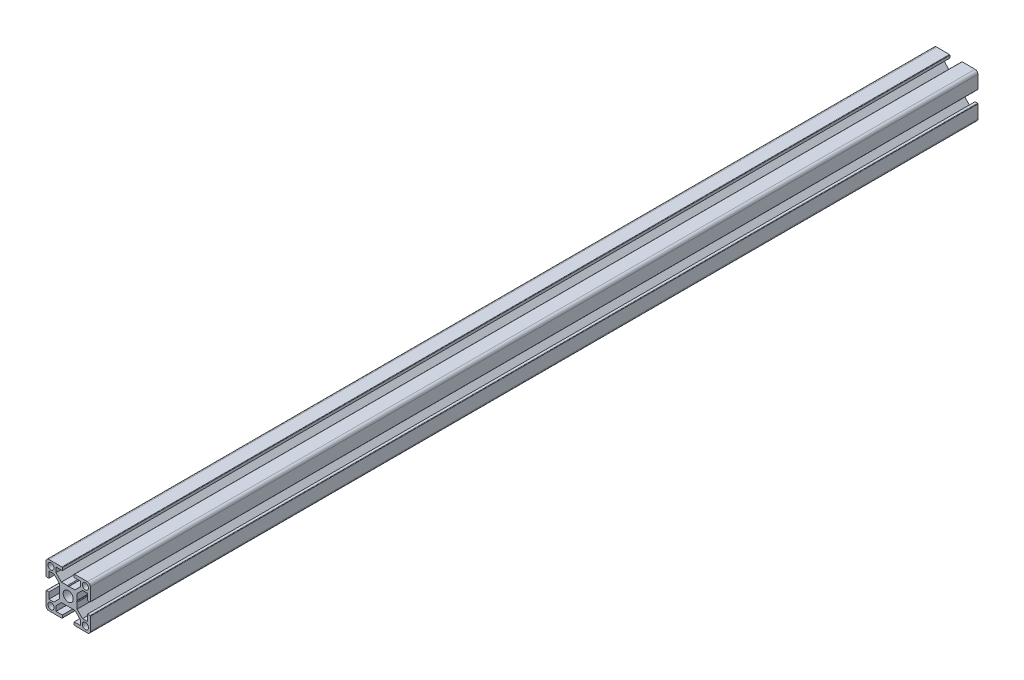
from build123d import *

# Parameters (mm, degrees)
SKETCH1_R           = 2.1
SKETCH1_R_2         = 3.4
BOSS_EXTRUDE1_DEPTH = 600


with BuildPart() as part:
    # Sketch1 → Boss-Extrude1 (new body)
    with BuildSketch(Plane.XY):
        with BuildLine():
            Line((-15, -4.3), (-15, -13))
            ThreePointArc((-15, -13), (-14.414213562, -14.414213562), (-13, -15))
            Line((-13, -15), (-4.3, -15))
            ThreePointArc((-4.3, -15), (-4.087867966, -14.912132034), (-4, -14.7))
            Line((-4, -14.7), (-4, -13))
            Line((-4, -13), (-8.249996, -13))
            Line((-8.249996, -13), (-8.249996, -9.664209562))
            Line((-8.249996, -9.664209562), (-4.585786438, -6))
            Line((-4.585786438, -6), (-0.519615242, -6))
            Line((-0.519615242, -6), (0, -5.7))
            Line((0, -5.7), (0.519615242, -6))
            Line((0.519615242, -6), (4.585786438, -6))
            Line((4.585786438, -6), (8.250004, -9.664217562))
            Line((8.250004, -9.664217562), (8.250004, -13))
            Line((8.250004, -13), (4, -13))
            Line((4, -13), (4, -14.7))
            ThreePointArc((4, -14.7), (4.087867966, -14.912132034), (4.3, -15))
            Line((4.3, -15), (13, -15))
            ThreePointArc((13, -15), (14.414213562, -14.414213562), (15, -13))
            Line((15, -13), (15, -4.3))
            ThreePointArc((15, -4.3), (14.912132034, -4.087867966), (14.7, -4))
            Line((14.7, -4), (13, -4))
            Line((13, -4), (13, -8.25))
            Line((13, -8.25), (9.664213562, -8.25))
            Line((9.664213562, -8.25), (6, -4.585786438))
            Line((6, -4.585786438), (6, -0.519615242))
            Line((6, -0.519615242), (5.7, 0))
            Line((5.7, 0), (6, 0.519615242))
            Line((6, 0.519615242), (6, 4.585786438))
            Line((6, 4.585786438), (9.664213562, 8.25))
            Line((9.664213562, 8.25), (13, 8.25))
            Line((13, 8.25), (13, 4))
            Line((13, 4), (14.7, 4))
            ThreePointArc((14.7, 4), (14.912132034, 4.087867966), (15, 4.3))
            Line((15, 4.3), (15, 13))
            ThreePointArc((15, 13), (14.414213562, 14.414213562), (13, 15))
            Line((13, 15), (4.3, 15))
            ThreePointArc((4.3, 15), (4.087867966, 14.912132034), (4, 14.7))
            Line((4, 14.7), (4, 13))
            Line((4, 13), (8.25, 13))
            Line((8.25, 13), (8.25, 9.664213562))
            Line((8.25, 9.664213562), (4.585786438, 6))
            Line((4.585786438, 6), (0.519615242, 6))
            Line((0.519615242, 6), (0, 5.7))
            Line((0, 5.7), (-0.519615242, 6))
            Line((-0.519615242, 6), (-4.585786438, 6))
            Line((-4.585786438, 6), (-8.25, 9.664213562))
            Line((-8.25, 9.664213562), (-8.25, 13))
            Line((-8.25, 13), (-4, 13))
            Line((-4, 13), (-4, 14.7))
            ThreePointArc((-4, 14.7), (-4.087867966, 14.912132034), (-4.3, 15))
            Line((-4.3, 15), (-13, 15))
            ThreePointArc((-13, 15), (-14.414213562, 14.414213562), (-15, 13))
            Line((-15, 13), (-15, 4.3))
            ThreePointArc((-15, 4.3), (-14.912132034, 4.087867966), (-14.7, 4))
            Line((-14.7, 4), (-13, 4))
            Line((-13, 4), (-13, 8.25))
            Line((-13, 8.25), (-9.664213562, 8.25))
            Line((-9.664213562, 8.25), (-6, 4.585786438))
            Line((-6, 4.585786438), (-6, 0.519615242))
            Line((-6, 0.519615242), (-5.7, 0))
            Line((-5.7, 0), (-6, -0.519615242))
            Line((-6, -0.519615242), (-6, -4.585786438))
            Line((-6, -4.585786438), (-9.664213562, -8.25))
            Line((-9.664213562, -8.25), (-13, -8.25))
            Line((-13, -8.25), (-13, -4))
            Line((-13, -4), (-14.7, -4))
            ThreePointArc((-14.7, -4), (-14.912132034, -4.087867966), (-15, -4.3))
        make_face()
        with Locations((11.625, -11.625)):
            Circle(SKETCH1_R, mode=Mode.SUBTRACT)
        with Locations((11.625, 11.625)):
            Circle(SKETCH1_R, mode=Mode.SUBTRACT)
        Circle(SKETCH1_R_2, mode=Mode.SUBTRACT)
        with Locations((-11.625, -11.625)):
            Circle(SKETCH1_R, mode=Mode.SUBTRACT)
        with Locations((-11.625, 11.625)):
            Circle(SKETCH1_R, mode=Mode.SUBTRACT)
    extrude(amount=-BOSS_EXTRUDE1_DEPTH)


solid = part.part
